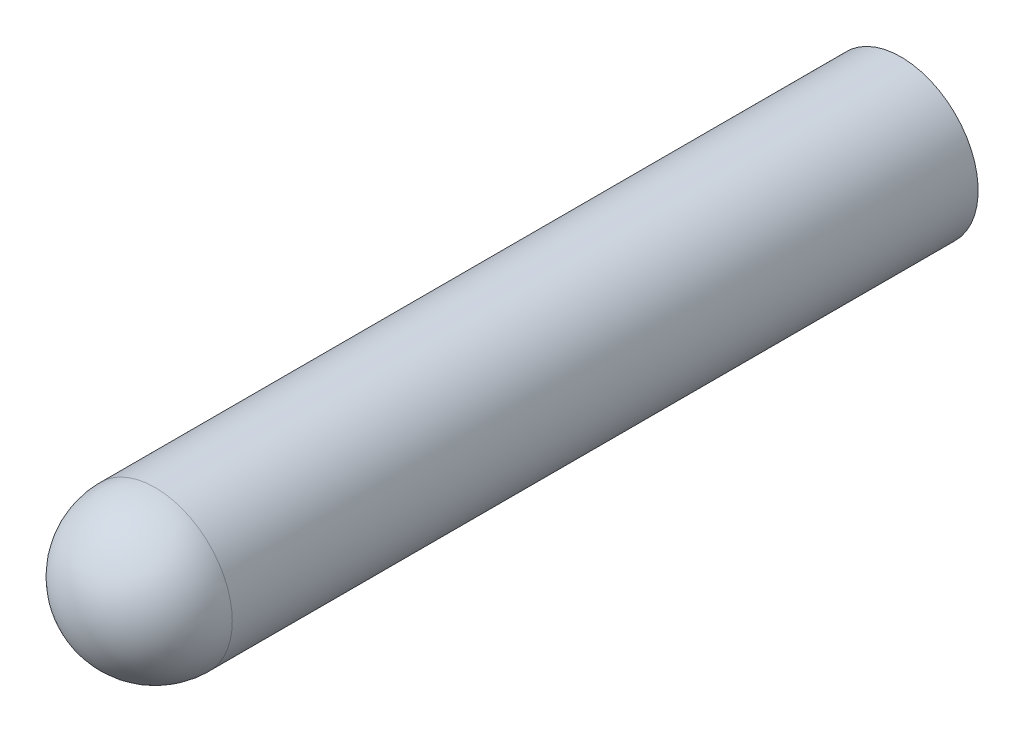
from build123d import *

# Parameters (mm, degrees)
SKETCH1_R           = 1.5
BOSS_EXTRUDE1_DEPTH = 14.5
DOME1_FACE_RADIUS   = 1.5
DOME1_HEIGHT        = 1.5


with BuildPart() as part:
    # Sketch1 → Boss-Extrude1 (new body)
    with BuildSketch(Plane.XY):
        with Locations(Location((0, 0, 0), (0, 0, 180))):
            Circle(SKETCH1_R)
    extrude(amount=BOSS_EXTRUDE1_DEPTH)

    # Dome1: a dome of height H over a round flat face of radius A is a cap of a sphere of radius (A * A + H * H) / (2 * H)
    dome1_r = (DOME1_FACE_RADIUS * DOME1_FACE_RADIUS + DOME1_HEIGHT * DOME1_HEIGHT) / (2 * DOME1_HEIGHT)
    dome1_base = Plane((0, 0, 14.5), z_dir=(0, 0, 1))
    with Locations(dome1_base.offset(DOME1_HEIGHT - dome1_r)):
        dome1_ball = Sphere(dome1_r, mode=Mode.PRIVATE)
    add(split(dome1_ball, bisect_by=dome1_base, keep=Keep.TOP, mode=Mode.PRIVATE))


solid = part.part
